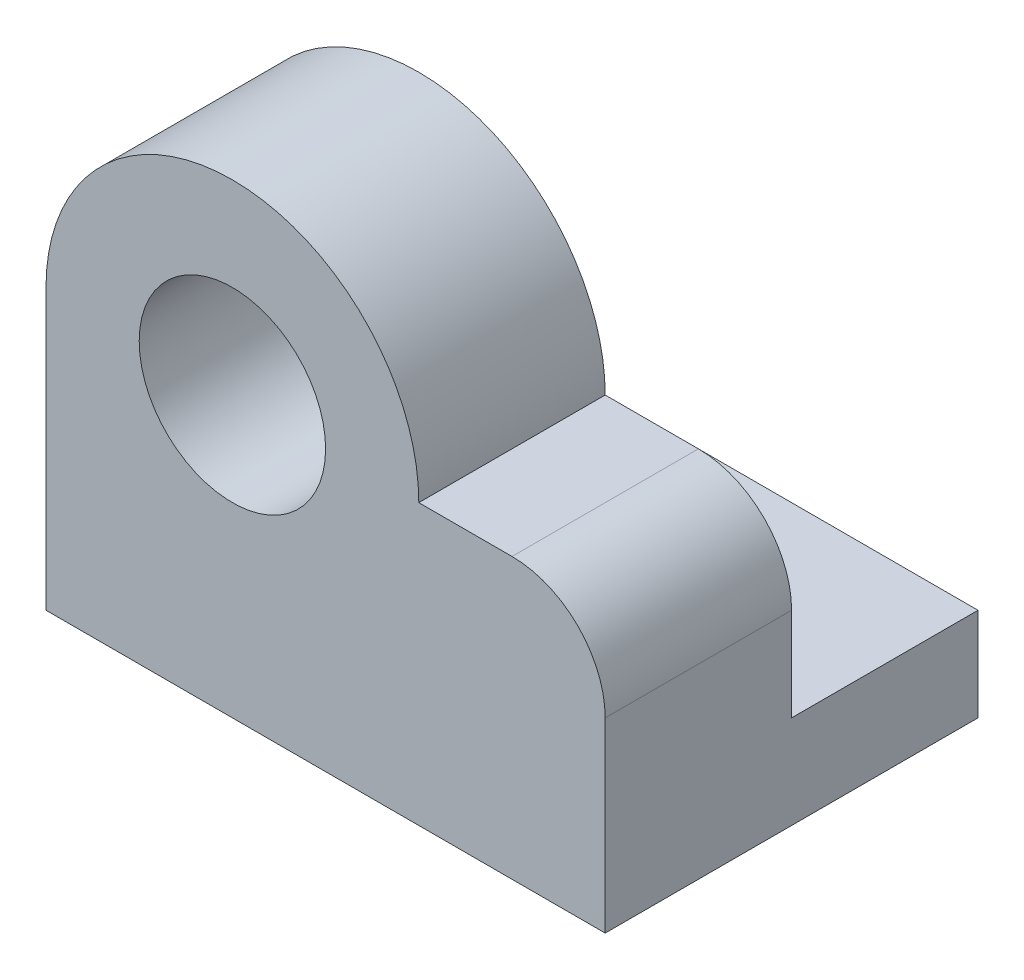
from build123d import *

# Parameters (mm, degrees)
BOSS_EXTRUDE4_DEPTH = 20
SKETCH6_W           = 60
SKETCH6_H           = 10
BOSS_EXTRUDE6_DEPTH = 40
SKETCH7_R           = 10
CUT_EXTRUDE2_DEPTH  = 40


with BuildPart() as part:
    # Sketch1 → Boss-Extrude4 (new body)
    with BuildSketch(Plane.XY):
        with BuildLine():
            Line((20, 0), (30, 0))
            ThreePointArc((30, 0), (37.071067812, -2.928932188), (40, -10))
            Line((40, -10), (40, -20))
            Line((40, -20), (-20, -20))
            Line((-20, -20), (-20, 0))
            ThreePointArc((-20, 0), (0, 20), (20, 0))
        make_face()
    extrude(amount=BOSS_EXTRUDE4_DEPTH)

    # Sketch6 → Boss-Extrude6 (add)
    with BuildSketch(Plane.XY.offset(20)):
        with Locations((10, -25)):
            Rectangle(SKETCH6_W, SKETCH6_H)
    extrude(amount=-BOSS_EXTRUDE6_DEPTH)

    # Sketch7 → Cut-Extrude2 (cut)
    with BuildSketch(Plane(origin=(0, 0, 0), x_dir=(-1, 0, 0), z_dir=(0, 0, -1))):
        Circle(SKETCH7_R)
    extrude(amount=-CUT_EXTRUDE2_DEPTH, mode=Mode.SUBTRACT)


solid = part.part
